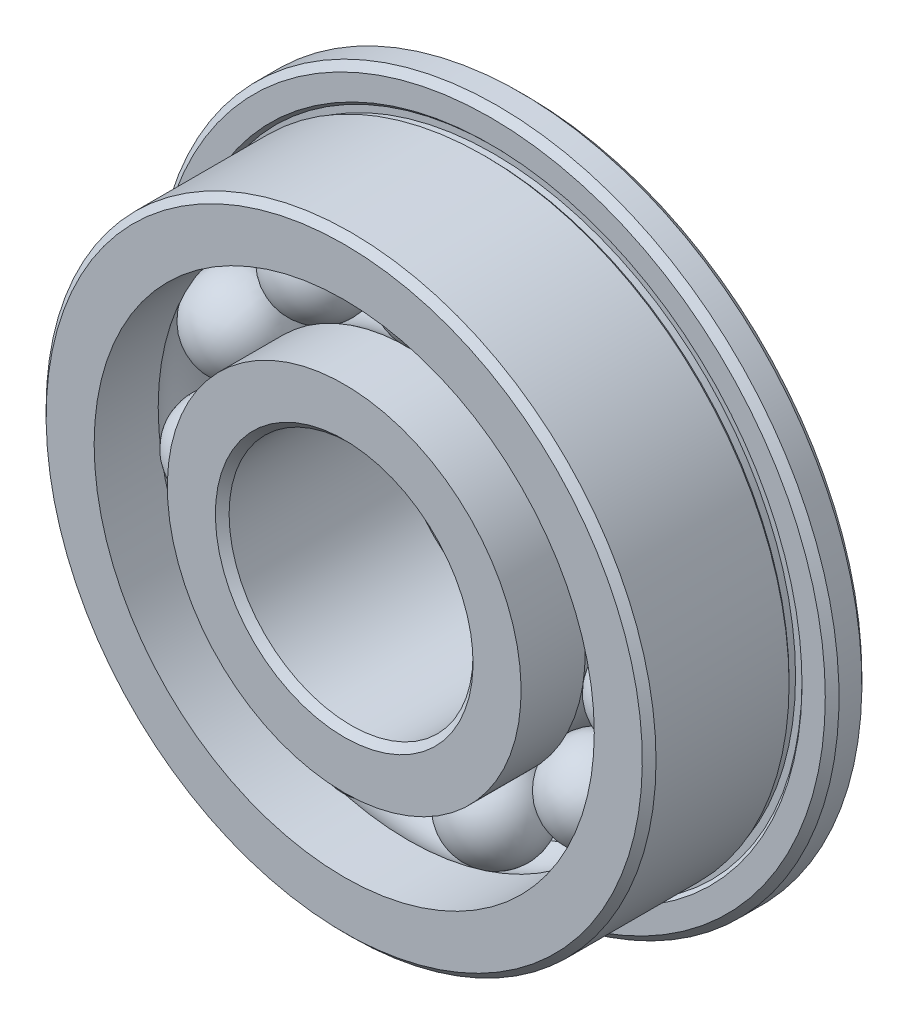
from build123d import *

# Parameters (mm, degrees)
FILLET1_SIZE      = 0.1125
FILLET2_SIZE      = 0.1125
CIRPATTERN3_COUNT = 11


with BuildPart() as part:
    # Sketch2 → Revolve1 (revolve)
    with BuildSketch(Plane(origin=(0, 0, 0), x_dir=(0, 0, -1), z_dir=(1, 0, 0)), mode=Mode.PRIVATE) as revolve1_sk:
        with BuildLine():
            Line((1.5, 5.6), (0.9, 5.6))
            Line((0.9, 5.6), (0.9, 5.106066017))
            Line((0.9, 5.106066017), (0.953033009, 5.053033009))
            Line((0.953033009, 5.053033009), (0.953033009, 4.946966991))
            Line((0.953033009, 4.946966991), (0.846966991, 4.946966991))
            Line((0.846966991, 4.946966991), (0.793933983, 5))
            Line((0.793933983, 5), (-1.5, 5))
            Line((-1.5, 5), (-1.5, 4.1))
            Line((-1.5, 4.1), (-0.45, 4.1))
            ThreePointArc((-0.45, 4.1), (0, 4.25), (0.45, 4.1))
            Line((0.45, 4.1), (1.5, 4.1))
            Line((1.5, 4.1), (1.5, 5.6))
        make_face()
        with BuildLine():
            Line((1.5, 2), (-1.5, 2))
            Line((-1.5, 2), (-1.5, 2.9))
            Line((-1.5, 2.9), (-0.45, 2.9))
            ThreePointArc((-0.45, 2.9), (0, 2.75), (0.45, 2.9))
            Line((0.45, 2.9), (1.5, 2.9))
            Line((1.5, 2.9), (1.5, 2))
        make_face()
    revolve(revolve1_sk.sketch.rotate(Axis((0, 0, 0), (0, 0, -1)), 180), axis=Axis((0, 0, 0), (0, 0, -1)))

    # Fillet1
    fillet1_edges = [part.edges().sort_by_distance(p)[0] for p in [
        (0, 5, 1.5),
        (0, 5.6, -1.5),
        (0, 5.6, -0.9),
    ]]
    chamfer(fillet1_edges, length=FILLET1_SIZE)

    # Fillet2
    fillet2_edges = [part.edges().sort_by_distance(p)[0] for p in [
        (0, 2, -1.5),
        (0, 2, 1.5),
    ]]
    chamfer(fillet2_edges, length=FILLET2_SIZE)


with BuildPart() as body_2:
    # Sketch7 → Revolve3 (revolve)
    with BuildSketch(Plane.XY):
        with BuildLine():
            Line((0, 4.25), (0, 2.75))
            ThreePointArc((0, 2.75), (-0.75, 3.5), (0, 4.25))
        make_face()
    revolve(axis=Axis((0, 4.25, 0), (0, -1, 0)))


with BuildPart() as cirpattern3_1:
    # CirPattern3: pattern copy
    add(body_2.part.rotate(Axis((0, 0, 0), (0, 0, 1)), 1 * 360 / CIRPATTERN3_COUNT))


with BuildPart() as cirpattern3_2:
    # CirPattern3: pattern copy
    add(body_2.part.rotate(Axis((0, 0, 0), (0, 0, 1)), 2 * 360 / CIRPATTERN3_COUNT))


with BuildPart() as cirpattern3_3:
    # CirPattern3: pattern copy
    add(body_2.part.rotate(Axis((0, 0, 0), (0, 0, 1)), 3 * 360 / CIRPATTERN3_COUNT))


with BuildPart() as cirpattern3_4:
    # CirPattern3: pattern copy
    add(body_2.part.rotate(Axis((0, 0, 0), (0, 0, 1)), 4 * 360 / CIRPATTERN3_COUNT))


with BuildPart() as cirpattern3_5:
    # CirPattern3: pattern copy
    add(body_2.part.rotate(Axis((0, 0, 0), (0, 0, 1)), 5 * 360 / CIRPATTERN3_COUNT))


with BuildPart() as cirpattern3_6:
    # CirPattern3: pattern copy
    add(body_2.part.rotate(Axis((0, 0, 0), (0, 0, 1)), 6 * 360 / CIRPATTERN3_COUNT))


with BuildPart() as cirpattern3_7:
    # CirPattern3: pattern copy
    add(body_2.part.rotate(Axis((0, 0, 0), (0, 0, 1)), 7 * 360 / CIRPATTERN3_COUNT))


with BuildPart() as cirpattern3_8:
    # CirPattern3: pattern copy
    add(body_2.part.rotate(Axis((0, 0, 0), (0, 0, 1)), 8 * 360 / CIRPATTERN3_COUNT))


with BuildPart() as cirpattern3_9:
    # CirPattern3: pattern copy
    add(body_2.part.rotate(Axis((0, 0, 0), (0, 0, 1)), 9 * 360 / CIRPATTERN3_COUNT))


with BuildPart() as cirpattern3_10:
    # CirPattern3: pattern copy
    add(body_2.part.rotate(Axis((0, 0, 0), (0, 0, 1)), 10 * 360 / CIRPATTERN3_COUNT))


solid = Compound([part.part, body_2.part, cirpattern3_1.part, cirpattern3_2.part, cirpattern3_3.part, cirpattern3_4.part, cirpattern3_5.part, cirpattern3_6.part, cirpattern3_7.part, cirpattern3_8.part, cirpattern3_9.part, cirpattern3_10.part])
